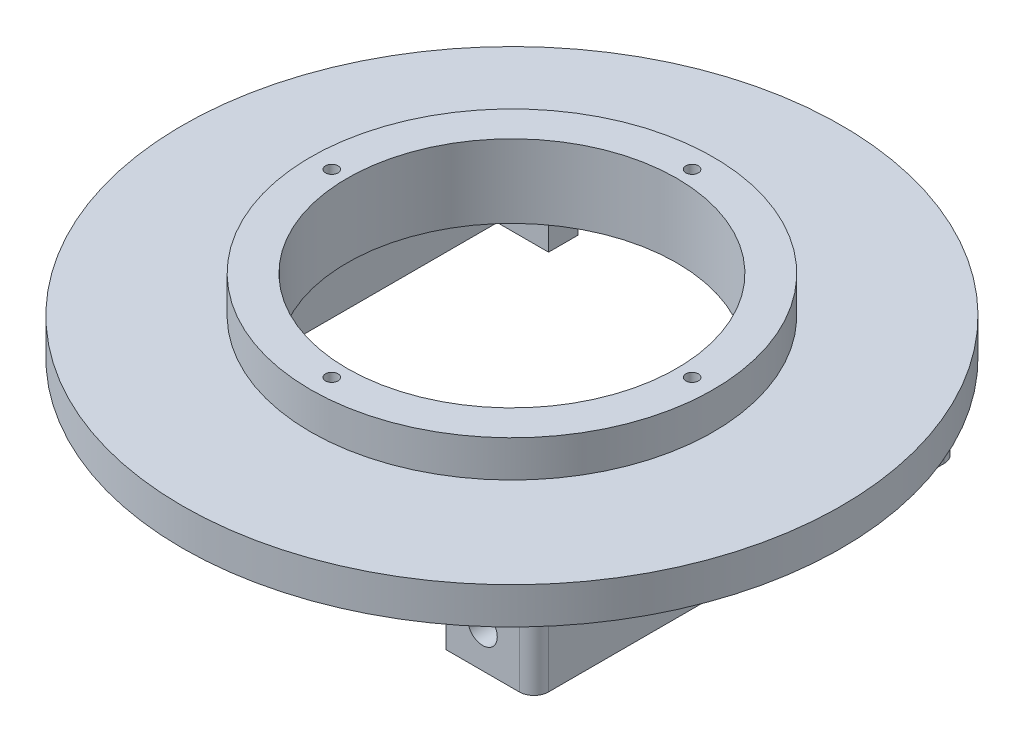
from build123d import *

# Parameters (mm, degrees)
SKETCH_2_R          = 45
SKETCH_2_R_2        = 22.5
EXTRUDE_1_DEPTH     = 5
EXTRUDE_2_DEPTH     = 10
FILLET_1_R          = 2
SKETCH_4_R          = 2
CUT_EXTRUDE_1_DEPTH = 88.183714076
SKETCH_5_R          = 27.5
SKETCH_5_R_2        = 22.5
EXTRUDE_3_DEPTH     = 5
SKETCH_6_R          = 0.85
CUT_EXTRUDE_2_DEPTH = 67.708320321


with BuildPart() as part:
    # 草图2 → 凸台-拉伸1 (new body)
    with BuildSketch(Plane(origin=(0, 0, 0), x_dir=(1, 0, 0), z_dir=(0, 1, 0))):
        with Locations(Location((0, 0, 0), (0, 0, 270))):
            Circle(SKETCH_2_R)
        with Locations(Location((0, 0, 0), (0, 0, 270))):
            Circle(SKETCH_2_R_2, mode=Mode.SUBTRACT)
    extrude(amount=EXTRUDE_1_DEPTH)

    # 草图3 → 凸台-拉伸2 (add)
    with BuildSketch(Plane.XZ):
        Polygon((-27, 25), (-27, -25), (-20, -25), (-20, -29), (-32, -29), (-32, -25), (-32, 25), (-32, 29), (-20, 29), (-20, 25), align=None)
        Polygon((20, -29), (20, -25), (27, -25), (27, 25), (20, 25), (20, 29), (32, 29), (32, 25), (32, -25), (32, -29), align=None)
    extrude(amount=EXTRUDE_2_DEPTH)

    # 圆角1
    fillet_1_edges = [part.edges().sort_by_distance(p)[0] for p in [
        (-32, -5, 29),
        (-32, -5, -29),
        (32, -5, -29),
        (32, -5, 29),
    ]]
    fillet(fillet_1_edges, radius=FILLET_1_R)

    # 草图4 → 切除-拉伸1 (cut, through all)
    with BuildSketch(Plane.XY.offset(29)):
        with Locations((-25, -5)):
            Circle(SKETCH_4_R)
        with Locations((25, -5)):
            Circle(SKETCH_4_R)
    extrude(amount=-CUT_EXTRUDE_1_DEPTH, mode=Mode.SUBTRACT)

    # 草图5 → 凸台-拉伸3 (add)
    with BuildSketch(Plane(origin=(0, 5, 0), x_dir=(1, 0, 0), z_dir=(0, 1, 0))):
        with Locations(Location((0, 0, 0), (0, 0, 270))):
            Circle(SKETCH_5_R)
        with Locations(Location((0, 0, 0), (0, 0, 270))):
            Circle(SKETCH_5_R_2, mode=Mode.SUBTRACT)
    extrude(amount=EXTRUDE_3_DEPTH)

    # 草图6 → 切除-拉伸2 (cut, through all)
    with BuildSketch(Plane(origin=(0, 10, 0), x_dir=(1, 0, 0), z_dir=(0, 1, 0))):
        with Locations(Location((0, 24.6, 0), (0, 0, 270))):
            Circle(SKETCH_6_R)
        with Locations(Location((24.6, 0, 0), (0, 0, 270))):
            Circle(SKETCH_6_R)
        with Locations(Location((0, -24.6, 0), (0, 0, 270))):
            Circle(SKETCH_6_R)
        with Locations(Location((-24.6, 0, 0), (0, 0, 270))):
            Circle(SKETCH_6_R)
    extrude(amount=-CUT_EXTRUDE_2_DEPTH, mode=Mode.SUBTRACT)


solid = part.part
